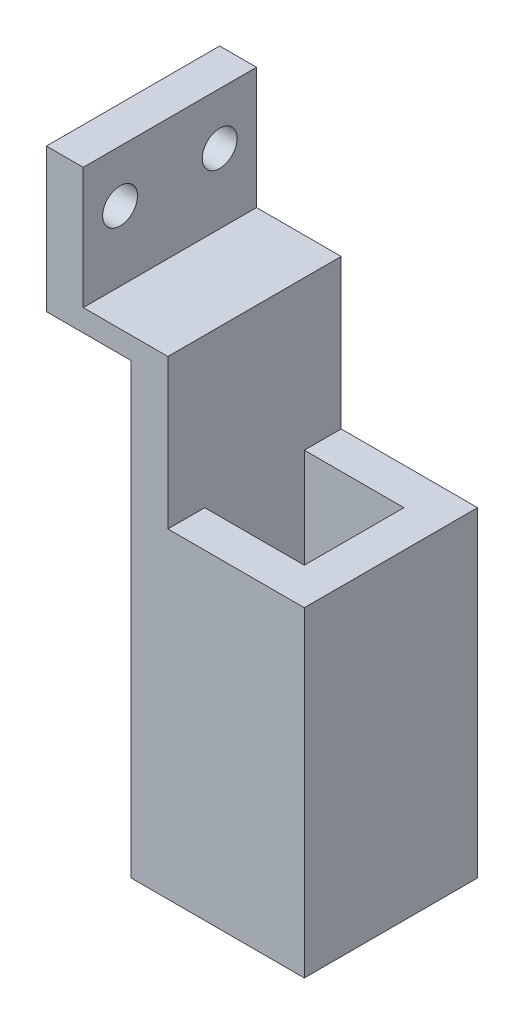
from build123d import *

# Parameters (mm, degrees)
BOSS_EXTRUDE1_DEPTH = 17.4
SKETCH3_W           = 10
SKETCH3_H           = 3.7
BOSS_EXTRUDE3_DEPTH = 30
SKETCH4_R           = 1.75
CUT_EXTRUDE1_DEPTH  = 55.985816353


with BuildPart() as part:
    # Sketch2 → Boss-Extrude1 (new body)
    with BuildSketch(Plane.XY):
        Polygon((-12.2, 12.2), (-8.5, 12.2), (-8.5, 0), (0, 0), (0, -45), (10, -45), (10, -15), (13.7, -15), (13.7, -47.2), (-3.7, -47.2), (-3.7, -2.2), (-12.2, -2.2), align=None)
    extrude(amount=BOSS_EXTRUDE1_DEPTH)

    # Sketch3 → Boss-Extrude3 (add)
    with BuildSketch(Plane.XZ.offset(45)):
        with Locations((5, 15.55)):
            Rectangle(SKETCH3_W, SKETCH3_H)
        with Locations((5, 1.85)):
            Rectangle(SKETCH3_W, SKETCH3_H)
    extrude(amount=-BOSS_EXTRUDE3_DEPTH)

    # Sketch4 → Cut-Extrude1 (cut, through all)
    with BuildSketch(Plane(origin=(-8.5, 0, 0), x_dir=(0, 0, -1), z_dir=(1, 0, 0))):
        with Locations((-13.7, 7)):
            Circle(SKETCH4_R)
        with Locations((-3.7, 7)):
            Circle(SKETCH4_R)
    extrude(amount=-CUT_EXTRUDE1_DEPTH, mode=Mode.SUBTRACT)


solid = part.part
